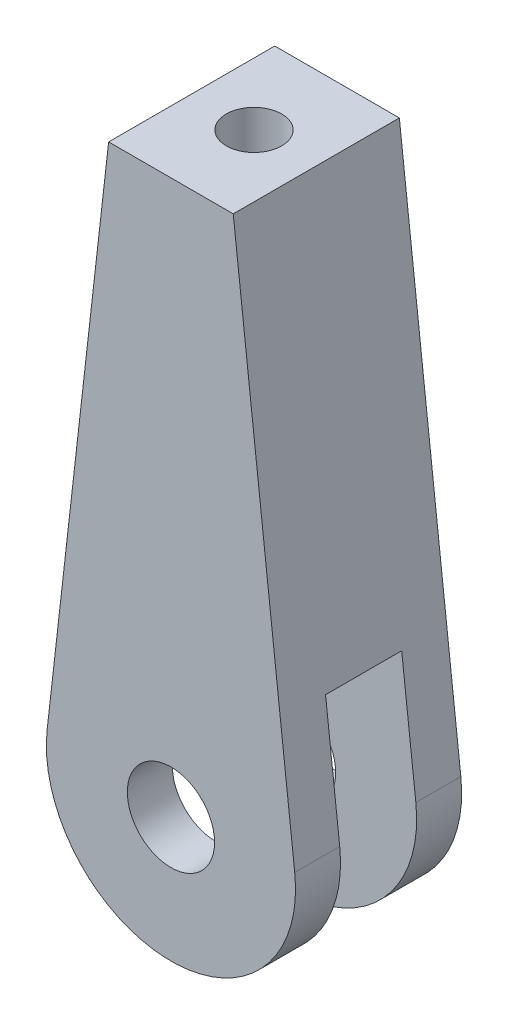
from build123d import *

# Parameters (mm, degrees)
BOSS_EXTRUDE1_DEPTH     = 12
SKETCH5_R               = 2
CUT_EXTRUDE4_DEPTH      = 12.5
CUT_EXTRUDE6_DEPTH      = 10
CUT_EXTRUDE6_DEPTH_BACK = 16
SKETCH9_W               = 19.938266946
SKETCH9_H               = 5.5
CUT_EXTRUDE8_DEPTH      = 43.720018727
CUT_EXTRUDE8_DEPTH_BACK = 43.720018727
SKETCH7_R               = 3.15


with BuildPart() as part:
    # Sketch1 → Boss-Extrude1 (new body)
    with BuildSketch(Plane.XY):
        with BuildLine():
            Line((4.5, 40), (-4.5, 40))
            Line((-4.5, 40), (-8.942125974, 1.019010828))
            ThreePointArc((-8.942125974, 1.019010828), (0, -9), (8.942125974, 1.019010828))
            Line((8.942125974, 1.019010828), (4.5, 40))
        make_face()
    extrude(amount=BOSS_EXTRUDE1_DEPTH)

    # Sketch5 → Cut-Extrude4 (cut)
    with BuildSketch(Plane(origin=(0, 40, 0), x_dir=(1, 0, 0), z_dir=(0, 1, 0))):
        with Locations(Location((0, -6, 0), (0, 0, 270))):
            Circle(SKETCH5_R)
    extrude(amount=-CUT_EXTRUDE4_DEPTH, mode=Mode.SUBTRACT)

    # Sketch9 → Cut-Extrude6 (cut, two sides: drawn at the far end of the back side and taken through both)
    with BuildSketch(Plane(origin=(0, 0, 0), x_dir=(1, 0, 0), z_dir=(0, 1, 0)).offset(-CUT_EXTRUDE6_DEPTH_BACK)):
        with Locations((0, -6)):
            Rectangle(SKETCH9_W, SKETCH9_H)
    extrude(amount=CUT_EXTRUDE6_DEPTH + CUT_EXTRUDE6_DEPTH_BACK, mode=Mode.SUBTRACT)

    # Sketch7 → Cut-Extrude8 (cut, two sides: drawn at the far end of the back side and taken through both)
    with BuildSketch(Plane.XY.offset(-CUT_EXTRUDE8_DEPTH_BACK)):
        Circle(SKETCH7_R)
    extrude(amount=CUT_EXTRUDE8_DEPTH + CUT_EXTRUDE8_DEPTH_BACK, mode=Mode.SUBTRACT)


solid = part.part
